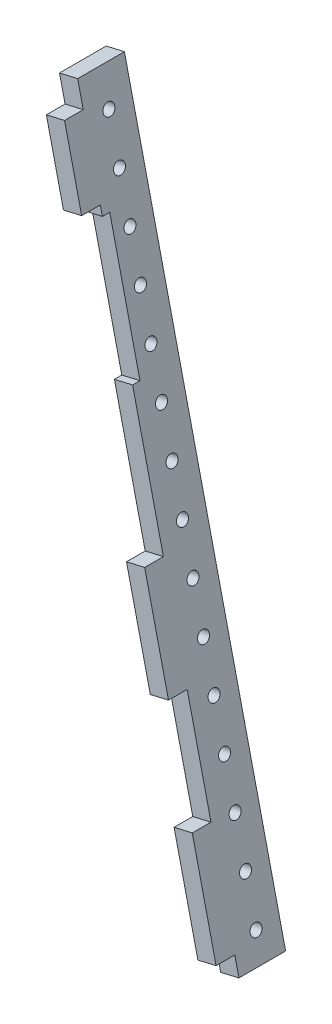
from build123d import *

# Parameters (mm, degrees)
BOSS_EXTRUDE1_DEPTH   = 10.16
BOSS_EXTRUDE1_2_DEPTH = 10.16
BOSS_EXTRUDE1_3_DEPTH = 10.16
BOSS_EXTRUDE2_DEPTH   = 25.4
SKETCH3_R             = 3.175
SKETCH3_W             = 29.218678694
SKETCH3_H             = 73
CUT_EXTRUDE1_DEPTH    = 1837.667023453


with BuildPart() as part:
    # Sketch1 → Boss-Extrude1 (new body)
    with BuildSketch(Plane.XY):
        Polygon((-120.524654614, 1641.945974367), (-107.584015199, 1585.893906943), (-117.483615058, 1583.608404231), (-130.424254473, 1639.660471655), align=None)
    extrude(amount=-BOSS_EXTRUDE1_DEPTH)



with BuildPart() as body_2:
    # Sketch1 → Boss-Extrude1 2 (new body)
    with BuildSketch(Plane.XY):
        Polygon((-104.542975642, 1527.556336807), (-94.643375784, 1529.841839519), (-81.702736369, 1473.789772095), (-91.602336227, 1471.504269383), align=None)
    extrude(amount=-BOSS_EXTRUDE1_2_DEPTH)


with BuildPart() as body_3:
    # Sketch1 → Boss-Extrude1 3 (new body)
    with BuildSketch(Plane.XY):
        Polygon((-164.706795155, 1788.154469528), (-154.807195296, 1790.43997224), (-164.092050064, 1830.657096664), (-173.991649923, 1828.371593952), align=None)
    extrude(amount=-BOSS_EXTRUDE1_3_DEPTH)


with BuildPart() as part_1:
    add(part.part)

    add(body_2.part)  # Boss-Extrude2 merges body 2

    add(body_3.part)  # Boss-Extrude2 merges body 3
    # Sketch2 → Boss-Extrude2 (add)
    with BuildSketch(Plane(origin=(0, 0, -10.16), x_dir=(-1, 0, 0), z_dir=(0, 0, -1))):
        Polygon((177.016251562, 1841.472582982), (89.352825684, 1461.760568735), (79.453225826, 1464.046071447), (167.116651704, 1843.758085694), align=None)
    extrude(amount=BOSS_EXTRUDE2_DEPTH)

    # Sketch3 → Cut-Extrude1 (cut, through all)
    with BuildSketch(Plane(origin=(235.565521709, 54.384585889, 0), x_dir=(0, 0, 1), z_dir=(-0.974370064785235, -0.22495105434386642, 0))):
        with Locations(Location((-22.86, 1459.395752405, 0), (0, 0, 270))):
            Circle(SKETCH3_R)
        with Locations(Location((-22.86, 1484.795752405, 0), (0, 0, 270))):
            Circle(SKETCH3_R)
        with Locations(Location((-22.86, 1510.195752405, 0), (0, 0, 270))):
            Circle(SKETCH3_R)
        with Locations(Location((-22.86, 1535.595752405, 0), (0, 0, 270))):
            Circle(SKETCH3_R)
        with Locations(Location((-22.86, 1560.995752405, 0), (0, 0, 270))):
            Circle(SKETCH3_R)
        with Locations(Location((-22.86, 1586.395752405, 0), (0, 0, 270))):
            Circle(SKETCH3_R)
        with Locations(Location((-22.86, 1611.795752405, 0), (0, 0, 270))):
            Circle(SKETCH3_R)
        with Locations(Location((-22.86, 1637.195752405, 0), (0, 0, 270))):
            Circle(SKETCH3_R)
        with Locations(Location((-22.86, 1662.595752405, 0), (0, 0, 270))):
            Circle(SKETCH3_R)
        with Locations(Location((-22.86, 1687.995752405, 0), (0, 0, 270))):
            Circle(SKETCH3_R)
        with Locations(Location((-22.86, 1713.395752405, 0), (0, 0, 270))):
            Circle(SKETCH3_R)
        with Locations(Location((-22.86, 1738.795752405, 0), (0, 0, 270))):
            Circle(SKETCH3_R)
        with Locations(Location((-22.86, 1764.195752405, 0), (0, 0, 270))):
            Circle(SKETCH3_R)
        with Locations(Location((-22.86, 1789.595752405, 0), (0, 0, 270))):
            Circle(SKETCH3_R)
        with Locations(Location((-22.86, 1814.995752405, 0), (0, 0, 270))):
            Circle(SKETCH3_R)
        with Locations((0.449339347, 1737.875153548)):
            Rectangle(SKETCH3_W, SKETCH3_H)
    extrude(amount=-CUT_EXTRUDE1_DEPTH, mode=Mode.SUBTRACT)


solid = part_1.part
